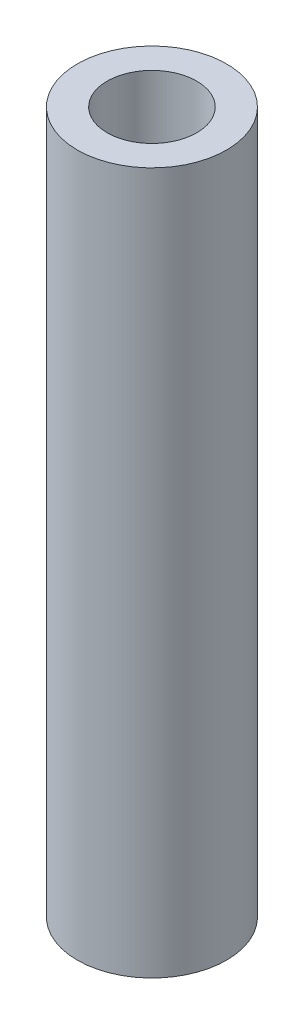
from build123d import *

# Parameters (mm, degrees)
SKETCH1_R           = 5
SKETCH1_R_2         = 3
BOSS_EXTRUDE1_DEPTH = 47


with BuildPart() as part:
    # Sketch1 → Boss-Extrude1 (new body)
    with BuildSketch(Plane(origin=(0, 0, 0), x_dir=(1, 0, 0), z_dir=(0, 1, 0))):
        with Locations(Location((0, 0, 0), (0, 0, 270))):
            Circle(SKETCH1_R)
        with Locations(Location((0, 0, 0), (0, 0, 270))):
            Circle(SKETCH1_R_2, mode=Mode.SUBTRACT)
    extrude(amount=BOSS_EXTRUDE1_DEPTH)


solid = part.part
